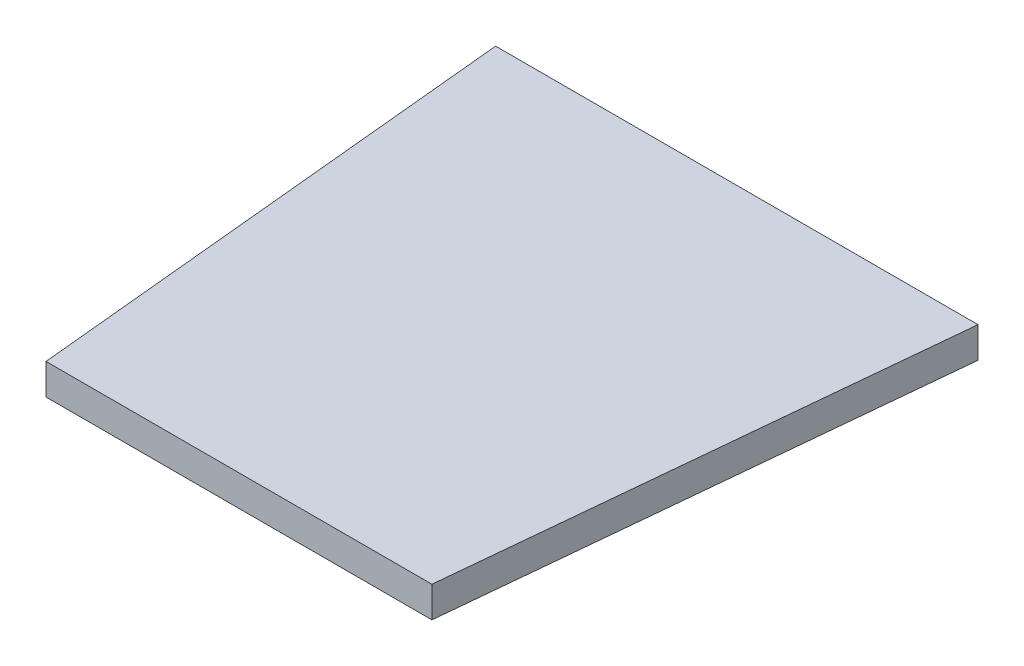
from build123d import *

# Parameters (mm, degrees)
BOSS_EXTRUDE1_DEPTH = 1.6


with BuildPart() as part:
    # Sketch1 → Boss-Extrude1 (new body)
    with BuildSketch(Plane(origin=(0, 0, 0), x_dir=(1, 0, 0), z_dir=(0, 1, 0))):
        Polygon((10, -11.970212766), (-10, -11.970212766), (-12.5, 13.829787234), (12.5, 13.829787234), align=None)
    extrude(amount=BOSS_EXTRUDE1_DEPTH)


solid = part.part
